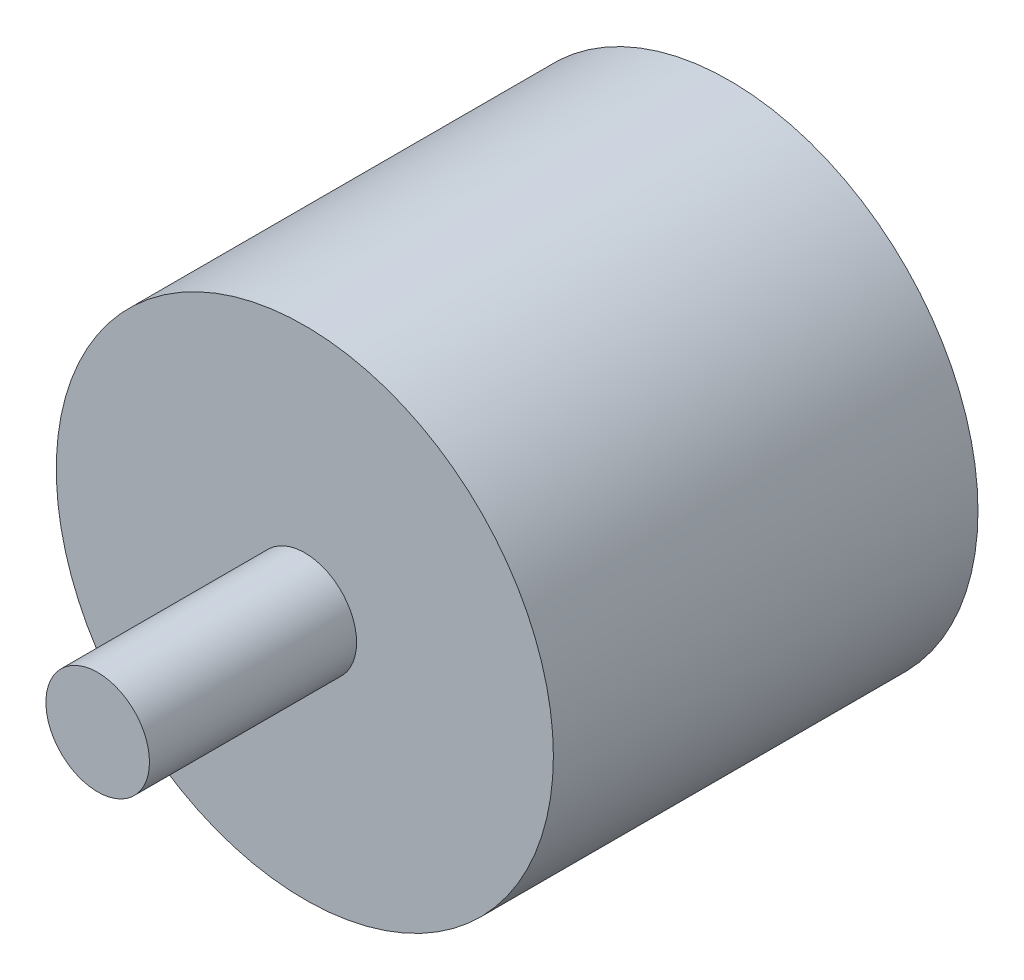
from build123d import *

# Parameters (mm, degrees)
ESQUISSE1_R        = 12
BOSS_EXTRU_1_DEPTH = 20.5
ESQUISSE2_R        = 2.5
BOSS_EXTRU_2_DEPTH = 10


with BuildPart() as part:
    # Esquisse1 → Boss.-Extru.1 (new body)
    with BuildSketch(Plane.XY):
        Circle(ESQUISSE1_R)
    extrude(amount=BOSS_EXTRU_1_DEPTH)

    # Esquisse2 → Boss.-Extru.2 (add)
    with BuildSketch(Plane.XY.offset(20.5)):
        Circle(ESQUISSE2_R)
    extrude(amount=BOSS_EXTRU_2_DEPTH)


solid = part.part
